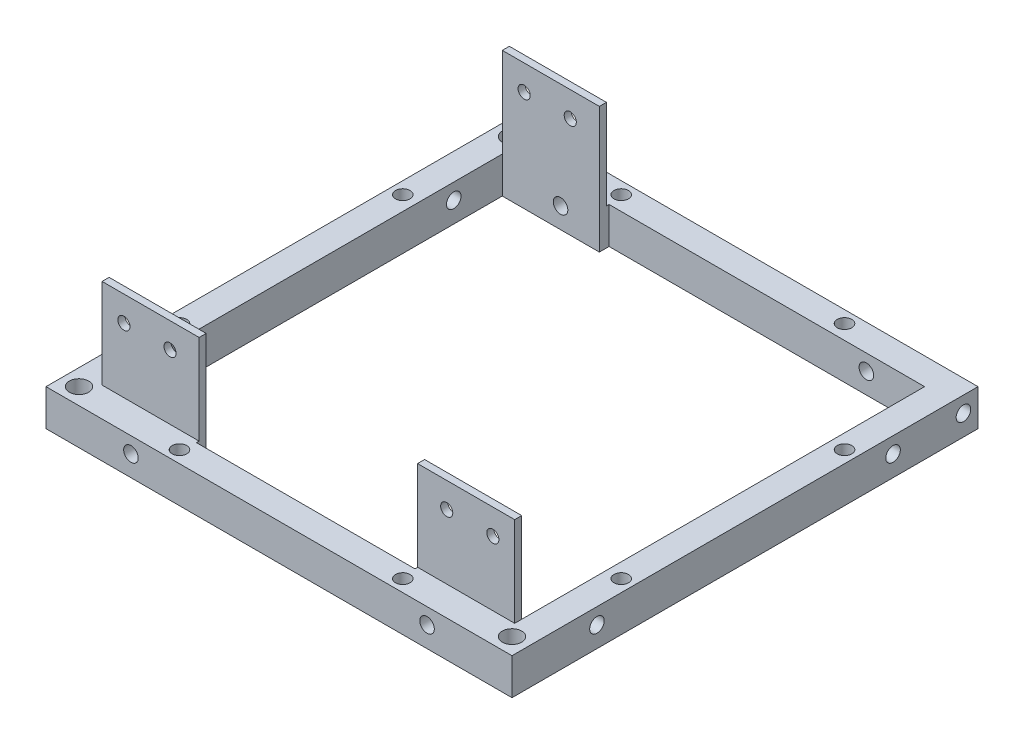
from build123d import *
from build123d.topology import SkipClean

# Parameters (mm, degrees)
SKETCH1_W                               = 96
SKETCH1_H                               = 96
SKETCH1_W_2                             = 80
SKETCH1_H_2                             = 80
BOSS_EXTRUDE1_DEPTH                     = 8
SKETCH27_W                              = 82
SKETCH27_H                              = 82
CUT_EXTRUDE2_DEPTH                      = 10
F_3_0_3_DIAMETER_HOLE1_D                = 3
TAP_DRILL_FOR_M3X0_5_TAP2_D             = 3
SKETCH38_W                              = 85
SKETCH38_H                              = 85
CUT_EXTRUDE4_DEPTH                      = 10
F_3_0_3_DIAMETER_HOLE7_D                = 3
SKETCH44_W                              = 4
SKETCH44_H                              = 4
BOSS_EXTRUDE2_DEPTH                     = 8
SKETCH45_W                              = 4
SKETCH45_H                              = 3.5
BOSS_EXTRUDE3_DEPTH                     = 8
SKETCH49_W                              = 96
SKETCH49_H                              = 1.5
CUT_EXTRUDE5_DEPTH                      = 146
TAP_DRILL_FOR_M4_TAP1_D                 = 4
SKETCH53_W                              = 4
SKETCH53_H                              = 6.5
BOSS_EXTRUDE5_DEPTH                     = 78
SKETCH57_W                              = 4
SKETCH57_H                              = 6.5
CUT_EXTRUDE6_DEPTH                      = 7.5
SKETCH58_W                              = 4
SKETCH58_H                              = 6.5
BOSS_EXTRUDE7_DEPTH                     = 81
SKETCH61_W                              = 32
SKETCH61_H                              = 85
CUT_EXTRUDE7_DEPTH                      = 81
SKETCH66_W                              = 85
SKETCH66_H                              = 80.198
CUT_EXTRUDE8_DEPTH                      = 10
SKETCH67_W                              = 85
SKETCH67_H                              = 85
CUT_EXTRUDE9_DEPTH                      = 3.5
SKETCH68_W                              = 52
SKETCH68_H                              = 85
CUT_EXTRUDE10_DEPTH                     = 56
SKETCH54_W                              = 20
SKETCH54_H                              = 1.45
BOSS_EXTRUDE8_DEPTH                     = 18.5
CUT_EXTRUDE12_START                     = -10.22
SKETCH75_W                              = 2.401
SKETCH75_H                              = 3
CUT_EXTRUDE12_DEPTH                     = 72.44
SKETCH77_W                              = 2.401
SKETCH77_H                              = 3
CUT_EXTRUDE13_DEPTH                     = 6.28
SKETCH78_W                              = 85
SKETCH78_H                              = 85
CUT_EXTRUDE14_DEPTH                     = 6.5
SKETCH79_W                              = 85
SKETCH79_H                              = 85
SKETCH79_W_2                            = 81
SKETCH79_H_2                            = 81
BOSS_EXTRUDE12_DEPTH                    = 6.5
SKETCH82_W                              = 1.25
SKETCH82_H                              = 7.5
TAP_DRILL_FOR_M2_5X0_45_TAP2_AT_2_COUNT = 2
TAP_DRILL_FOR_M2_5X0_45_TAP2_AT_2_PITCH = 9.5
TAP_DRILL_FOR_M2_5X0_45_TAP2_AT_3_COUNT = 2
TAP_DRILL_FOR_M2_5X0_45_TAP2_AT_3_PITCH = 66.5
TAP_DRILL_FOR_M2_5X0_45_TAP2_AT_4_COUNT = 2
TAP_DRILL_FOR_M2_5X0_45_TAP2_AT_4_PITCH = 57
SKETCH84_W                              = 1.25
SKETCH84_H                              = 1.451
TAP_DRILL_FOR_M2_5X0_45_TAP3_AT_2_COUNT = 2
TAP_DRILL_FOR_M2_5X0_45_TAP3_AT_2_PITCH = 9.5
SKETCH86_W                              = 1.5
SKETCH86_H                              = 7.5
SKETCH88_W                              = 2
SKETCH88_H                              = 70
SKETCH88_W_2                            = 70
SKETCH88_H_2                            = 2
CUT_EXTRUDE15_DEPTH                     = 10
SKETCH89_W                              = 85
SKETCH89_H                              = 81
CUT_EXTRUDE16_DEPTH                     = 10
SKETCH90_W                              = 2
SKETCH90_H                              = 6.5
CUT_EXTRUDE17_DEPTH                     = 7.5
SKETCH91_W                              = 96
SKETCH91_H                              = 96
SKETCH91_R                              = 1.5
SKETCH91_R_2                            = 2
BOSS_EXTRUDE14_DEPTH                    = 1
SKETCH92_W                              = 12.5
SKETCH92_H                              = 2
BOSS_EXTRUDE15_DEPTH                    = 1
SKETCH94_W                              = 12.5
SKETCH94_H                              = 2
BOSS_EXTRUDE16_DEPTH                    = 1
SKETCH95_W                              = 12.5
SKETCH95_H                              = 2
BOSS_EXTRUDE17_DEPTH                    = 1
SKETCH96_W                              = 12.5
SKETCH96_H                              = 6.5
SKETCH96_R                              = 1.5
BOSS_EXTRUDE18_DEPTH                    = 2
SKETCH97_W                              = 12.5
SKETCH97_H                              = 6.5
SKETCH97_R                              = 1.5
BOSS_EXTRUDE19_DEPTH                    = 2


with BuildPart() as part:
    # Sketch1 → Boss-Extrude1 (new body)
    with BuildSketch(Plane(origin=(0, 0, 0), x_dir=(1, 0, 0), z_dir=(0, 1, 0))):
        Rectangle(SKETCH1_W, SKETCH1_H)
        Rectangle(SKETCH1_W_2, SKETCH1_H_2, mode=Mode.SUBTRACT)
    extrude(amount=BOSS_EXTRUDE1_DEPTH)

    # Sketch27 → Cut-Extrude2 (cut)
    with BuildSketch(Plane(origin=(0, 8, 0), x_dir=(1, 0, 0), z_dir=(0, 1, 0))):
        Rectangle(SKETCH27_W, SKETCH27_H)
    extrude(amount=-CUT_EXTRUDE2_DEPTH, mode=Mode.SUBTRACT)

    # Ø3.0 (3) Diameter Hole1 (through all)
    with Locations(Plane.XY.offset(48)):
        with Locations((-30.5, 3.25), (30.5, 3.25)):
            Hole(F_3_0_3_DIAMETER_HOLE1_D / 2)

    # Tap Drill for M3x0.5 Tap2 (through all)
    with Locations(Plane(origin=(0, 0, 0), x_dir=(-1, 0, 0), z_dir=(0, -1, 0))):
        with Locations((23, -45.5), (-23, -45.5), (-45.5, -23), (-45.5, 23), (-23, 45.5), (23, 45.5), (45.5, 23), (45.5, -23)):
            Hole(TAP_DRILL_FOR_M3X0_5_TAP2_D / 2)

    # Sketch38 → Cut-Extrude4 (cut)
    with BuildSketch(Plane(origin=(0, 8, 0), x_dir=(1, 0, 0), z_dir=(0, 1, 0))):
        Rectangle(SKETCH38_W, SKETCH38_H)
    extrude(amount=-CUT_EXTRUDE4_DEPTH, mode=Mode.SUBTRACT)

    # Ø3.0 (3) Diameter Hole7 (through all)
    with Locations(Plane.ZY.offset(48)):
        with Locations((-30.5, 3.25), (30.5, 3.25)):
            Hole(F_3_0_3_DIAMETER_HOLE7_D / 2)

    # Sketch44 → Boss-Extrude2 (add)
    with BuildSketch(Plane.XZ):
        with Locations((40.5, -40.5)):
            Rectangle(SKETCH44_W, SKETCH44_H)
        with Locations((-40.5, -40.5)):
            Rectangle(SKETCH44_W, SKETCH44_H)
        with Locations((-40.5, 40.5)):
            Rectangle(SKETCH44_W, SKETCH44_H)
        with Locations((40.5, 40.5)):
            Rectangle(SKETCH44_W, SKETCH44_H)
    extrude(amount=-BOSS_EXTRUDE2_DEPTH)

    # Sketch45 → Boss-Extrude3 (add)
    with BuildSketch(Plane(origin=(0, 8, 0), x_dir=(1, 0, 0), z_dir=(0, 1, 0))):
        with Locations((-40.5, 36.75)):
            Rectangle(SKETCH45_W, SKETCH45_H)
    extrude(amount=-BOSS_EXTRUDE3_DEPTH)

    # Sketch49 → Cut-Extrude5 (cut)
    with BuildSketch(Plane(origin=(48, 0, 0), x_dir=(0, 0, -1), z_dir=(1, 0, 0))):
        with Locations((0, 7.25)):
            Rectangle(SKETCH49_W, SKETCH49_H)
    extrude(amount=-CUT_EXTRUDE5_DEPTH, mode=Mode.SUBTRACT)

    # Tap Drill for M4 Tap1 (through all)
    with Locations(Plane(origin=(0, 6.5, 0), x_dir=(1, 0, 0), z_dir=(0, 1, 0))):
        with Locations((44.6, -44.6), (-44.6, -44.6), (-44.6, 44.6)):
            Hole(TAP_DRILL_FOR_M4_TAP1_D / 2)

    # Sketch53 → Boss-Extrude5 (add)
    with BuildSketch(Plane(origin=(-38.5, 0, 0), x_dir=(0, 0, -1), z_dir=(1, 0, 0))):
        with Locations((-40.5, 3.25)):
            Rectangle(SKETCH53_W, SKETCH53_H)
    extrude(amount=BOSS_EXTRUDE5_DEPTH)

    # Sketch57 → Cut-Extrude6 (cut)
    with BuildSketch(Plane.XY.offset(-35)):
        with Locations((-40.5, 3.25)):
            Rectangle(SKETCH57_W, SKETCH57_H)
    extrude(amount=-CUT_EXTRUDE6_DEPTH, mode=Mode.SUBTRACT)

    # Sketch58 → Boss-Extrude7 (add)
    with BuildSketch(Plane.ZY.offset(-38.5)):
        with Locations((-40.5, 3.25)):
            Rectangle(SKETCH58_W, SKETCH58_H)
    extrude(amount=BOSS_EXTRUDE7_DEPTH)

    # Sketch61 → Cut-Extrude7 (cut)
    with BuildSketch(Plane(origin=(0, 6.5, 0), x_dir=(1, 0, 0), z_dir=(0, 1, 0))):
        Rectangle(SKETCH61_W, SKETCH61_H)
    extrude(amount=-CUT_EXTRUDE7_DEPTH, mode=Mode.SUBTRACT)

    # Sketch66 → Cut-Extrude8 (cut)
    with BuildSketch(Plane(origin=(0, 6.5, 0), x_dir=(1, 0, 0), z_dir=(0, 1, 0))):
        Rectangle(SKETCH66_W, SKETCH66_H)
    extrude(amount=-CUT_EXTRUDE8_DEPTH, mode=Mode.SUBTRACT)

    # Sketch67 → Cut-Extrude9 (cut)
    with BuildSketch(Plane.XZ):
        Rectangle(SKETCH67_W, SKETCH67_H)
    extrude(amount=-CUT_EXTRUDE9_DEPTH, mode=Mode.SUBTRACT)

    # Sketch68 → Cut-Extrude10 (cut)
    with BuildSketch(Plane(origin=(0, 6.5, 0), x_dir=(1, 0, 0), z_dir=(0, 1, 0))):
        Rectangle(SKETCH68_W, SKETCH68_H)
    extrude(amount=-CUT_EXTRUDE10_DEPTH, mode=Mode.SUBTRACT)

    # Sketch54 → Boss-Extrude8 (add)
    with BuildSketch(Plane(origin=(0, 6.5, 0), x_dir=(1, 0, 0), z_dir=(0, 1, 0))):
        with Locations((-32.5, -41.225)):
            Rectangle(SKETCH54_W, SKETCH54_H)
    boss_extrude8 = extrude(amount=BOSS_EXTRUDE8_DEPTH)

    # Mirror1: Boss-Extrude8 across plane
    add(boss_extrude8.mirror(Plane(origin=(0, 0, 0), x_dir=(0, 0, 1), z_dir=(1, 0, 0))))

    # Sketch75 → Cut-Extrude12 (cut)
    with BuildSketch(Plane.ZY.offset(-26).offset(CUT_EXTRUDE12_START)):
        with Locations((41.2995, 5)):
            Rectangle(SKETCH75_W, SKETCH75_H)
    cut_extrude12 = extrude(amount=CUT_EXTRUDE12_DEPTH, mode=Mode.SUBTRACT)

    # Mirror2: Boss-Extrude8 across plane
    add(boss_extrude8.mirror(Plane.XY))

    # Mirror3: Cut-Extrude12 across plane
    add(cut_extrude12.mirror(Plane.XY), mode=Mode.SUBTRACT)

    # Sketch77 → Cut-Extrude13 (cut)
    with BuildSketch(Plane.ZY.offset(-36.22)):
        with Locations((-41.2995, 5)):
            Rectangle(SKETCH77_W, SKETCH77_H)
    extrude(amount=-CUT_EXTRUDE13_DEPTH, mode=Mode.SUBTRACT)

    # Sketch78 → Cut-Extrude14 (cut)
    with BuildSketch(Plane.XZ):
        Rectangle(SKETCH78_W, SKETCH78_H)
    extrude(amount=-CUT_EXTRUDE14_DEPTH, mode=Mode.SUBTRACT)


with BuildPart() as cut_extrude14_piece_1:
    # of the separate pieces the step leaves, piece 1, a body of its own (cut_extrude14_pieces)
    add(part.part.solids().sort_by_distance((48, 0, 48))[0])

    # Sketch79 → Boss-Extrude12 (add)
    with BuildSketch(Plane.XZ):
        Rectangle(SKETCH79_W, SKETCH79_H)
        Rectangle(SKETCH79_W_2, SKETCH79_H_2, mode=Mode.SUBTRACT)
    extrude(amount=-BOSS_EXTRUDE12_DEPTH)

    # Sketch86 → Tap Drill for M3x0.5 Tap4 (revolve, cut)
    with BuildSketch(Plane(origin=(48, 3.25, -45), x_dir=(0, 0, -1), z_dir=(0, 1, 0))):
        with Locations((0.75, 3.75)):
            Rectangle(SKETCH86_W, SKETCH86_H)
    revolve(axis=Axis((54.35, 3.25, -45), (-1, 0, 0)), mode=Mode.SUBTRACT)

    # Sketch88 → Cut-Extrude15 (cut)
    with BuildSketch(Plane(origin=(0, 6.5, 0), x_dir=(1, 0, 0), z_dir=(0, 1, 0))):
        with Locations((41.5, 0)):
            Rectangle(SKETCH88_W, SKETCH88_H)
        with Locations((0, -41.5)):
            Rectangle(SKETCH88_W_2, SKETCH88_H_2)
        with Locations((-41.5, 0)):
            Rectangle(SKETCH88_W, SKETCH88_H)
        with Locations((0, 41.5)):
            Rectangle(SKETCH88_W_2, SKETCH88_H_2)
    extrude(amount=-CUT_EXTRUDE15_DEPTH, mode=Mode.SUBTRACT)

    # Sketch89 → Cut-Extrude16 (cut)
    with BuildSketch(Plane(origin=(0, 6.5, 0), x_dir=(1, 0, 0), z_dir=(0, 1, 0))):
        Rectangle(SKETCH89_W, SKETCH89_H)
    extrude(amount=-CUT_EXTRUDE16_DEPTH, mode=Mode.SUBTRACT)

    # Sketch90 → Cut-Extrude17 (cut)
    with BuildSketch(Plane.ZY.offset(-35)):
        with Locations((-41.5, 3.25)):
            Rectangle(SKETCH90_W, SKETCH90_H)
    extrude(amount=-CUT_EXTRUDE17_DEPTH, mode=Mode.SUBTRACT)

    # Sketch91 → Boss-Extrude14 (add)
    with SkipClean():  # the faces are left unmerged after this step: merging them gives an invalid solid
        with BuildSketch(Plane.XZ):
            Rectangle(SKETCH91_W, SKETCH91_H)
            with Locations(Location((23, -45.5, 0), (0, 0, 270))):
                Circle(SKETCH91_R, mode=Mode.SUBTRACT)
            with Locations(Location((-23, -45.5, 0), (0, 0, 270))):
                Circle(SKETCH91_R, mode=Mode.SUBTRACT)
            with Locations(Location((44.6, 44.6, 0), (0, 0, 90))):
                Circle(SKETCH91_R_2, mode=Mode.SUBTRACT)
            with Locations(Location((-45.5, -23, 0), (0, 0, 270))):
                Circle(SKETCH91_R, mode=Mode.SUBTRACT)
            with Locations(Location((-45.5, 23, 0), (0, 0, 270))):
                Circle(SKETCH91_R, mode=Mode.SUBTRACT)
            with Locations(Location((-23, 45.5, 0), (0, 0, 270))):
                Circle(SKETCH91_R, mode=Mode.SUBTRACT)
            with Locations(Location((23, 45.5, 0), (0, 0, 270))):
                Circle(SKETCH91_R, mode=Mode.SUBTRACT)
            with Locations(Location((45.5, 23, 0), (0, 0, 270))):
                Circle(SKETCH91_R, mode=Mode.SUBTRACT)
            with Locations(Location((-44.6, -44.6, 0), (0, 0, 90))):
                Circle(SKETCH91_R_2, mode=Mode.SUBTRACT)
            with Locations(Location((45.5, -23, 0), (0, 0, 270))):
                Circle(SKETCH91_R, mode=Mode.SUBTRACT)
            with Locations(Location((-44.6, 44.6, 0), (0, 0, 90))):
                Circle(SKETCH91_R_2, mode=Mode.SUBTRACT)
            Polygon((42.5, -42.5), (-35, -42.5), (-35, -40.5), (-42.5, -40.5), (-42.5, 40.5), (-35, 40.5), (-35, 42.5), (35, 42.5), (35, 40.5), (42.5, 40.5), align=None, mode=Mode.SUBTRACT)
        extrude(amount=BOSS_EXTRUDE14_DEPTH)



with BuildPart() as cut_extrude14_piece_2:
    # of the separate pieces the step leaves, piece 2, a body of its own (cut_extrude14_pieces)
    add(part.part.solids().sort_by_distance((-42.5, 25, -40.5))[0])

    # Sketch84 → Tap Drill for M2.5x0.45 Tap3 (revolve, cut)
    with BuildSketch(Plane(origin=(-28.5, 19.79923894, -40.5), x_dir=(0, -1, 0), z_dir=(1, 0, 0))):
        with Locations((0.625, 0.7255)):
            Rectangle(SKETCH84_W, SKETCH84_H)
    tap_drill_for_m2_5x0_45_tap3 = revolve(axis=Axis((-28.5, 19.79923894, -34.15), (0, 0, -1)), mode=Mode.SUBTRACT)

    # Tap Drill for M2.5x0.45 Tap3 at 2: Tap Drill for M2.5x0.45 Tap3 ×2
    with Locations(*[(-i * TAP_DRILL_FOR_M2_5X0_45_TAP3_AT_2_PITCH, 0, 0) for i in range(1, TAP_DRILL_FOR_M2_5X0_45_TAP3_AT_2_COUNT)]):
        add(tap_drill_for_m2_5x0_45_tap3, mode=Mode.SUBTRACT)


with BuildPart() as cut_extrude14_piece_3:
    # of the separate pieces the step leaves, piece 3, a body of its own (cut_extrude14_pieces)
    add(part.part.solids().sort_by_distance((-42.5, 25, 40.5))[0])

    # Sketch82 → Tap Drill for M2.5x0.45 Tap2 (revolve, cut)
    with BuildSketch(Plane(origin=(-28.5, 19.79923894, 40.5), x_dir=(0, 1, 0), z_dir=(1, 0, 0))):
        with Locations((0.625, 3.75)):
            Rectangle(SKETCH82_W, SKETCH82_H)
    tap_drill_for_m2_5x0_45_tap2 = revolve(axis=Axis((-28.5, 19.79923894, 34.15), (0, 0, 1)), mode=Mode.SUBTRACT)

    # Tap Drill for M2.5x0.45 Tap2 at 2: Tap Drill for M2.5x0.45 Tap2 ×2
    with Locations(*[(-i * TAP_DRILL_FOR_M2_5X0_45_TAP2_AT_2_PITCH, 0, 0) for i in range(1, TAP_DRILL_FOR_M2_5X0_45_TAP2_AT_2_COUNT)]):
        add(tap_drill_for_m2_5x0_45_tap2, mode=Mode.SUBTRACT)


with BuildPart() as cut_extrude14_piece_4:
    # of the separate pieces the step leaves, piece 4, a body of its own (cut_extrude14_pieces)
    add(part.part.solids().sort_by_distance((42.5, 25, 40.5))[0])

    # Tap Drill for M2.5x0.45 Tap2 at 3: Tap Drill for M2.5x0.45 Tap2 ×2
    with Locations(*[(i * TAP_DRILL_FOR_M2_5X0_45_TAP2_AT_3_PITCH, 0, 0) for i in range(1, TAP_DRILL_FOR_M2_5X0_45_TAP2_AT_3_COUNT)]):
        add(tap_drill_for_m2_5x0_45_tap2, mode=Mode.SUBTRACT)

    # Tap Drill for M2.5x0.45 Tap2 at 4: Tap Drill for M2.5x0.45 Tap2 ×2
    with Locations(*[(i * TAP_DRILL_FOR_M2_5X0_45_TAP2_AT_4_PITCH, 0, 0) for i in range(1, TAP_DRILL_FOR_M2_5X0_45_TAP2_AT_4_COUNT)]):
        add(tap_drill_for_m2_5x0_45_tap2, mode=Mode.SUBTRACT)


with BuildPart() as cut_extrude14_piece_1_1:
    with SkipClean():  # the faces are left unmerged after this step: merging them gives an invalid solid
        add(cut_extrude14_piece_1.part)

        add(cut_extrude14_piece_3.part)  # Boss-Extrude15 merges Cut-Extrude14 piece 3
        # Sketch92 → Boss-Extrude15 (add)
        with BuildSketch(Plane.XZ.offset(-6.5)):
            with Locations((-28.75, 41.5)):
                Rectangle(SKETCH92_W, SKETCH92_H)
        extrude(amount=BOSS_EXTRUDE15_DEPTH)


    with SkipClean():  # the faces are left unmerged after this step: merging them gives an invalid solid
        add(cut_extrude14_piece_4.part)  # Boss-Extrude16 merges Cut-Extrude14 piece 4
        # Sketch94 → Boss-Extrude16 (add)
        with BuildSketch(Plane.XZ.offset(-6.5)):
            with Locations((28.75, 41.5)):
                Rectangle(SKETCH94_W, SKETCH94_H)
        extrude(amount=BOSS_EXTRUDE16_DEPTH)


    with SkipClean():  # the faces are left unmerged after this step: merging them gives an invalid solid
        add(cut_extrude14_piece_2.part)  # Boss-Extrude17 merges Cut-Extrude14 piece 2
        # Sketch95 → Boss-Extrude17 (add)
        with BuildSketch(Plane.XZ.offset(-6.5)):
            with Locations((-28.75, -41.5)):
                Rectangle(SKETCH95_W, SKETCH95_H)
        extrude(amount=BOSS_EXTRUDE17_DEPTH)

    # Sketch96 → Boss-Extrude18 (add)
    with SkipClean():  # the faces are left unmerged after this step: merging them gives an invalid solid
        with BuildSketch(Plane.XY.offset(-42.5)):
            with Locations((-28.75, 2.25)):
                Rectangle(SKETCH96_W, SKETCH96_H)
            with Locations((-30.5, 3.25)):
                Circle(SKETCH96_R, mode=Mode.SUBTRACT)
        extrude(amount=BOSS_EXTRUDE18_DEPTH)

    # Sketch97 → Boss-Extrude19 (add)
    # profile 1 of 2: a face of its own
    with SkipClean():  # the faces are left unmerged after this step: merging them gives an invalid solid
        with BuildSketch(Plane(origin=(0, 0, 42.5), x_dir=(-1, 0, 0), z_dir=(0, 0, -1))):
            with Locations((-28.75, 2.25)):
                Rectangle(SKETCH97_W, SKETCH97_H)
            with Locations(Location((-30.5, 3.25, 0), (0, 0, 180))):
                Circle(SKETCH97_R, mode=Mode.SUBTRACT)
        # profile 2 of 2: a face of its own
        with BuildSketch(Plane(origin=(0, 0, 42.5), x_dir=(-1, 0, 0), z_dir=(0, 0, -1))):
            with Locations((28.75, 2.25)):
                Rectangle(SKETCH97_W, SKETCH97_H)
            with Locations(Location((30.5, 3.25, 0), (0, 0, 180))):
                Circle(SKETCH97_R, mode=Mode.SUBTRACT)
        extrude(amount=BOSS_EXTRUDE19_DEPTH)


solid = cut_extrude14_piece_1_1.part
